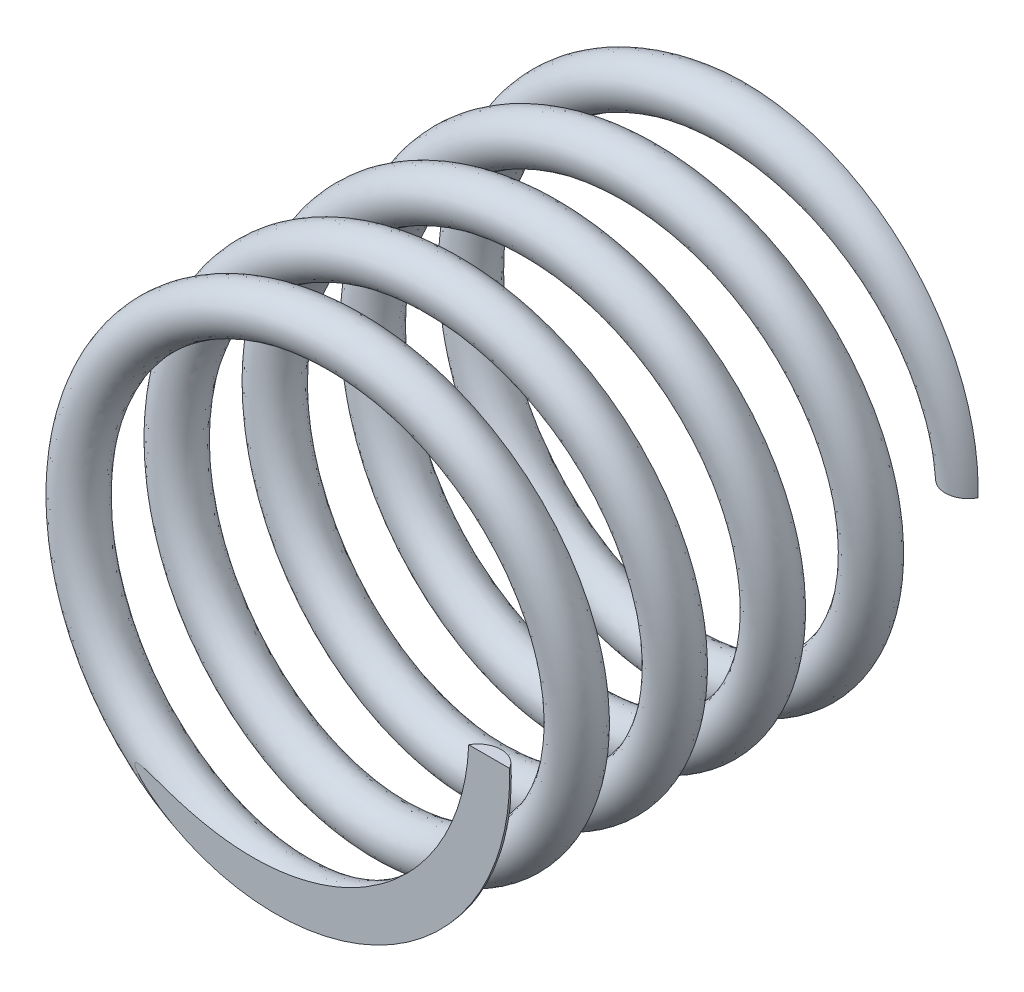
from build123d import *

# Parameters (mm, degrees)
SWEEP1_PITCH  = 12.7
SWEEP1_HEIGHT = 63.5
SWEEP1_RADIUS = 29
SKETCH2_R     = 3


with BuildPart() as part:
    # Sweep1: sweep along a helix
    with BuildLine() as sweep1_path:
        Helix(SWEEP1_PITCH, SWEEP1_HEIGHT, SWEEP1_RADIUS, center=(0, 0, 0), direction=(0, 0, 1))
    # Sketch2 → Sweep1 (sweep)
    with BuildSketch(Plane(origin=(0, 0, 0), x_dir=(1, 0, 0), z_dir=(0, 1, 0))):
        with Locations((29, 0)):
            Circle(SKETCH2_R)
    sweep(path=sweep1_path.line, is_frenet=True)

    # SurfaceCut1
    split(bisect_by=Plane.XY.offset(1.41693866), keep=Keep.TOP)

    # SurfaceCut4
    split(bisect_by=Plane(origin=(0, 0, 62.0733282), x_dir=(-1, 0, 0), z_dir=(0, 0, -1)), keep=Keep.TOP)


solid = part.part
